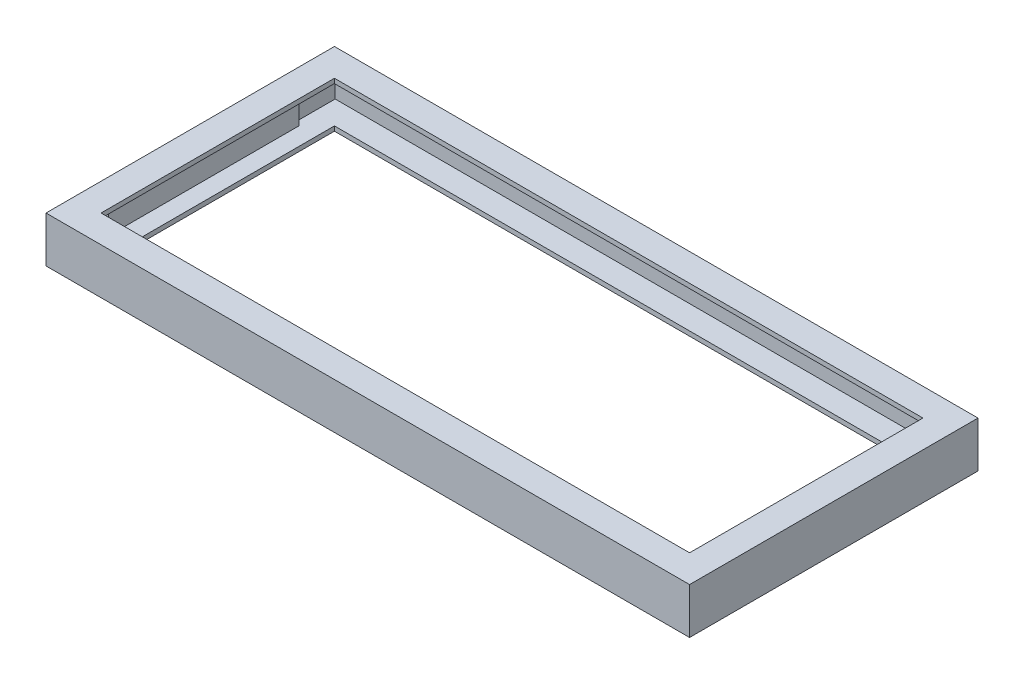
from build123d import *

# Parameters (mm, degrees)
SKETCH7_W           = 120.227524024
SKETCH7_H           = 41.502027866
BOSS_EXTRUDE4_DEPTH = 10
SKETCH9_W           = 60.894825735
SKETCH9_H           = 8
CUT_EXTRUDE4_DEPTH  = 9
SKETCH12_W          = 60.894825735
SKETCH12_H          = 8
CUT_EXTRUDE6_DEPTH  = 8
SKETCH14_W          = 138.336754021
SKETCH14_H          = 8
CUT_EXTRUDE7_DEPTH  = 9
SKETCH17_W          = 138.336754021
SKETCH17_H          = 8
CUT_EXTRUDE8_DEPTH  = 9
SKETCH20_W          = 128.336754021
SKETCH20_H          = 50.894825735
CUT_EXTRUDE10_DEPTH = 10


with BuildPart() as part:
    # Sketch7 → Boss-Extrude4 (new body)
    with BuildSketch(Plane(origin=(0, 0, 0), x_dir=(1, 0, 0), z_dir=(0, 1, 0))):
        Polygon((0, 0), (11.124254892, 0), (131.351778916, 0), (140.336754021, 0), (140.336754021, 62.894825735), (131.351778916, 62.894825735), (11.124254892, 62.894825735), (0, 62.894825735), align=None)
        with Locations((71.238016904, 32.303124782)):
            Rectangle(SKETCH7_W, SKETCH7_H, mode=Mode.SUBTRACT)
    extrude(amount=BOSS_EXTRUDE4_DEPTH)

    # Sketch9 → Cut-Extrude4 (cut)
    with BuildSketch(Plane(origin=(11.124254892, 0, 0), x_dir=(0, 0, -1), z_dir=(1, 0, 0))):
        with Locations((31.447412868, 5)):
            Rectangle(SKETCH9_W, SKETCH9_H)
    extrude(amount=-CUT_EXTRUDE4_DEPTH, mode=Mode.SUBTRACT)

    # Sketch12 → Cut-Extrude6 (cut)
    with BuildSketch(Plane.ZY.offset(-131.351778916)):
        with Locations((-31.447412868, 5)):
            Rectangle(SKETCH12_W, SKETCH12_H)
    extrude(amount=-CUT_EXTRUDE6_DEPTH, mode=Mode.SUBTRACT)

    # Sketch14 → Cut-Extrude7 (cut)
    with BuildSketch(Plane.XY.offset(-53.054138715)):
        with Locations((70.168377011, 5)):
            Rectangle(SKETCH14_W, SKETCH14_H)
    extrude(amount=-CUT_EXTRUDE7_DEPTH, mode=Mode.SUBTRACT)

    # Sketch17 → Cut-Extrude8 (cut)
    with BuildSketch(Plane(origin=(0, 0, -11.552110849), x_dir=(-1, 0, 0), z_dir=(0, 0, -1))):
        with Locations((-70.168377011, 5)):
            Rectangle(SKETCH17_W, SKETCH17_H)
    extrude(amount=-CUT_EXTRUDE8_DEPTH, mode=Mode.SUBTRACT)

    # Sketch20 → Cut-Extrude10 (cut)
    with BuildSketch(Plane(origin=(0, 10, 0), x_dir=(1, 0, 0), z_dir=(0, 1, 0))):
        with Locations((70.168377011, 31.447412868)):
            Rectangle(SKETCH20_W, SKETCH20_H)
    extrude(amount=-CUT_EXTRUDE10_DEPTH, mode=Mode.SUBTRACT)


solid = part.part
